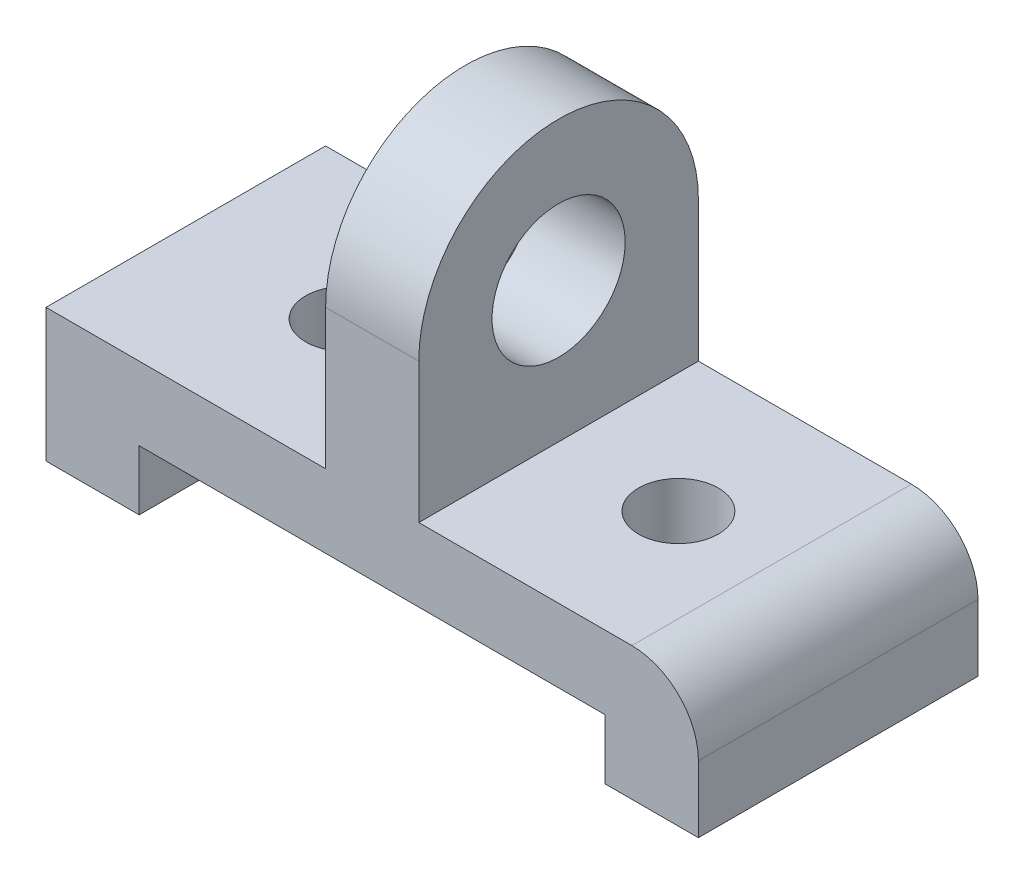
from build123d import *

# Parameters (mm, degrees)
SKETCH1_W           = 98
SKETCH1_H           = 42
BOSS_EXTRUDE1_DEPTH = 20
SKETCH2_W           = 70
SKETCH2_H           = 9
CUT_EXTRUDE1_DEPTH  = 68.564783726
SKETCH3_W           = 14
SKETCH3_H           = 42
BOSS_EXTRUDE2_DEPTH = 21
SKETCH4_R           = 21
BOSS_EXTRUDE3_DEPTH = 14
SKETCH5_R           = 6
CUT_EXTRUDE2_DEPTH  = 68.867518004
FILLET3_R           = 10
SKETCH6_R           = 10
CUT_EXTRUDE3_DEPTH  = 14


with BuildPart() as part:
    # Sketch1 → Boss-Extrude1 (new body)
    with BuildSketch(Plane(origin=(0, 0, 0), x_dir=(1, 0, 0), z_dir=(0, 1, 0))):
        Rectangle(SKETCH1_W, SKETCH1_H)
    extrude(amount=BOSS_EXTRUDE1_DEPTH)

    # Sketch2 → Cut-Extrude1 (cut, through all)
    with BuildSketch(Plane.XY.offset(21)):
        with Locations((0, 4.5)):
            Rectangle(SKETCH2_W, SKETCH2_H)
    extrude(amount=-CUT_EXTRUDE1_DEPTH, mode=Mode.SUBTRACT)

    # Sketch3 → Boss-Extrude2 (add)
    with BuildSketch(Plane(origin=(0, 20, 0), x_dir=(1, 0, 0), z_dir=(0, 1, 0))):
        Rectangle(SKETCH3_W, SKETCH3_H)
    extrude(amount=BOSS_EXTRUDE2_DEPTH)

    # Sketch4 → Boss-Extrude3 (add)
    with BuildSketch(Plane(origin=(7, 0, 0), x_dir=(0, 0, -1), z_dir=(1, 0, 0))):
        with Locations((0, 41)):
            Circle(SKETCH4_R)
    extrude(amount=-BOSS_EXTRUDE3_DEPTH)

    # Sketch5 → Cut-Extrude2 (cut, through all)
    with BuildSketch(Plane(origin=(0, 20, 0), x_dir=(1, 0, 0), z_dir=(0, 1, 0))):
        with Locations(Location((25, 0, 0), (0, 0, 270))):
            Circle(SKETCH5_R)
    cut_extrude2 = extrude(amount=-CUT_EXTRUDE2_DEPTH, mode=Mode.SUBTRACT)

    # Mirror1: Cut-Extrude2 across plane
    add(cut_extrude2.mirror(Plane(origin=(0, 0, 0), x_dir=(0, 0, 1), z_dir=(1, 0, 0))), mode=Mode.SUBTRACT)

    # Fillet3
    fillet3_edges = [part.edges().sort_by_distance(p)[0] for p in [
        (49, 20, 0),
    ]]
    fillet(fillet3_edges, radius=FILLET3_R)

    # Sketch6 → Cut-Extrude3 (cut)
    with BuildSketch(Plane(origin=(7, 0, 0), x_dir=(0, 0, -1), z_dir=(1, 0, 0))):
        with Locations((0, 41)):
            Circle(SKETCH6_R)
    extrude(amount=-CUT_EXTRUDE3_DEPTH, mode=Mode.SUBTRACT)


solid = part.part
